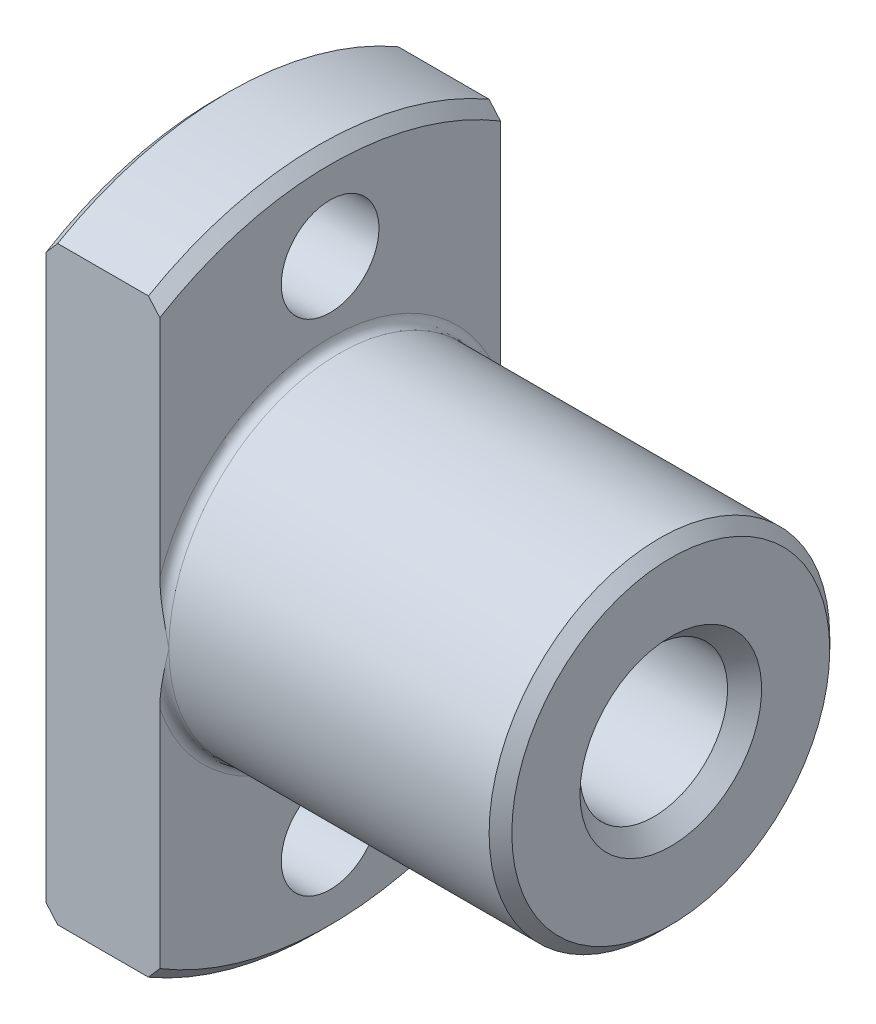
from build123d import *

# Parameters (mm, degrees)
SKETCH3_W               = 5
SKETCH3_H               = 2.15
SKETCH4_W               = 5
SKETCH4_H               = 2.15
CUT_EXTRUDE1_DEPTH      = 7.5
CUT_EXTRUDE1_DEPTH_BACK = 7.5
SKETCH5_W               = 30
SKETCH5_H               = 90
SKETCH5_W_2             = 15
SKETCH5_H_2             = 60


with BuildPart() as part:
    # Sketch1 → Revolve1 (revolve)
    with BuildSketch(Plane.XY, mode=Mode.PRIVATE) as revolve1_sk:
        with BuildLine():
            Line((0, 0), (0, 14.5))
            Line((0, 14.5), (0.5, 15))
            Line((0.5, 15), (4.5, 15))
            Line((4.5, 15), (5, 14.5))
            Line((5, 14.5), (5, 7.9))
            ThreePointArc((5, 7.9), (5.117157288, 7.617157288), (5.4, 7.5))
            Line((5.4, 7.5), (19.5, 7.5))
            Line((19.5, 7.5), (20, 7))
            Line((20, 7), (20, 0))
            Line((20, 0), (0, 0))
        make_face()
    revolve(revolve1_sk.sketch.rotate(Axis((20, 0, 0), (-1, 0, 0)), 270), axis=Axis((20, 0, 0), (-1, 0, 0)))

    # Sketch2 → Cut-Revolve1 (revolve, cut)
    with BuildSketch(Plane.XY, mode=Mode.PRIVATE) as cut_revolve1_sk:
        Polygon((0, 0), (0, 4), (0.75, 3.25), (19.25, 3.25), (20, 4), (20, 0), align=None)
    revolve(cut_revolve1_sk.sketch.rotate(Axis((20, 0, 0), (-1, 0, 0)), 270), axis=Axis((20, 0, 0), (-1, 0, 0)), mode=Mode.SUBTRACT)

    # Sketch3 → Cut-Revolve2 (revolve, cut)
    with BuildSketch(Plane.XY, mode=Mode.PRIVATE) as cut_revolve2_sk:
        with Locations((2.5, 12.075)):
            Rectangle(SKETCH3_W, SKETCH3_H)
    revolve(cut_revolve2_sk.sketch.rotate(Axis((5, 11, 0), (-1, 0, 0)), 270), axis=Axis((5, 11, 0), (-1, 0, 0)), mode=Mode.SUBTRACT)

    # Sketch4 → Cut-Revolve3 (revolve, cut)
    with BuildSketch(Plane.XY, mode=Mode.PRIVATE) as cut_revolve3_sk:
        with Locations((2.5, -9.925)):
            Rectangle(SKETCH4_W, SKETCH4_H)
    revolve(cut_revolve3_sk.sketch.rotate(Axis((5, -11, 0), (-1, 0, 0)), 270), axis=Axis((5, -11, 0), (-1, 0, 0)), mode=Mode.SUBTRACT)

    # Sketch5 → Cut-Extrude1 (cut, two sides: drawn at the far end of the back side and taken through both)
    with BuildSketch(Plane(origin=(0, 0, 0), x_dir=(0, 0, -1), z_dir=(1, 0, 0)).offset(-CUT_EXTRUDE1_DEPTH_BACK)):
        Rectangle(SKETCH5_W, SKETCH5_H)
        Rectangle(SKETCH5_W_2, SKETCH5_H_2, mode=Mode.SUBTRACT)
    extrude(amount=CUT_EXTRUDE1_DEPTH + CUT_EXTRUDE1_DEPTH_BACK, mode=Mode.SUBTRACT)


solid = part.part
